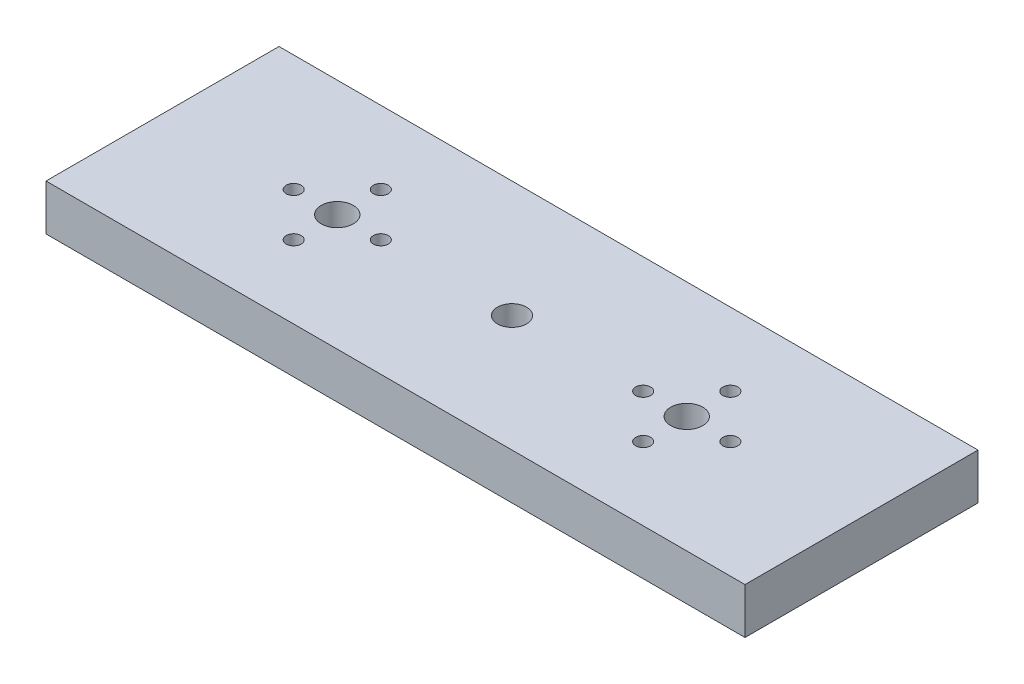
from build123d import *

# Parameters (mm, degrees)
SKETCH2_W                 = 304.8
SKETCH2_H                 = 101.6
SKETCH2_R                 = 6.35
SKETCH2_R_2               = 7
BOSS_EXTRUDE1_DEPTH       = 20
SKETCH3_R                 = 3.25
CUT_EXTRUDE1_DEPTH        = 162.883909021
CIRPATTERN1_COUNT         = 4
LPATTERN1_COUNT           = 2
LPATTERN1_PITCH           = 152.4
LPATTERN1_COPY_1_SKETCH_R = 3.25
LPATTERN1_COPY_1_DEPTH    = 162.883909021
LPATTERN1_COPY_2_SKETCH_R = 3.25
LPATTERN1_COPY_2_DEPTH    = 162.883909021
LPATTERN1_COPY_3_SKETCH_R = 3.25
LPATTERN1_COPY_3_DEPTH    = 162.883909021


with BuildPart() as part:
    # Sketch2 → Boss-Extrude1 (new body)
    with BuildSketch(Plane(origin=(0, 0, 0), x_dir=(1, 0, 0), z_dir=(0, 1, 0))):
        Rectangle(SKETCH2_W, SKETCH2_H)
        with Locations(Location((0, 0, 0), (0, 0, 270))):
            Circle(SKETCH2_R, mode=Mode.SUBTRACT)
        with Locations(Location((-76.2, 0, 0), (0, 0, 270))):
            Circle(SKETCH2_R_2, mode=Mode.SUBTRACT)
        with Locations(Location((76.2, 0, 0), (0, 0, 270))):
            Circle(SKETCH2_R_2, mode=Mode.SUBTRACT)
    extrude(amount=BOSS_EXTRUDE1_DEPTH)

    # Sketch3 → Cut-Extrude1 (cut, through all)
    with BuildSketch(Plane(origin=(0, 20, 0), x_dir=(1, 0, 0), z_dir=(0, 1, 0))):
        with Locations(Location((-76.2, 19, 0), (0, 0, 270))):
            Circle(SKETCH3_R)
    cut_extrude1 = extrude(amount=-CUT_EXTRUDE1_DEPTH, mode=Mode.SUBTRACT)

    # CirPattern1: Cut-Extrude1 ×4 about axis
    cirpattern1_axis = Axis((-76.2, 0, 0), (0, 1, 0))
    for i in range(1, CIRPATTERN1_COUNT):
        add(cut_extrude1.rotate(cirpattern1_axis, i * 360 / CIRPATTERN1_COUNT), mode=Mode.SUBTRACT)

    # LPattern1: Cut-Extrude1 ×2
    with Locations(*[(i * LPATTERN1_PITCH, 0, 0) for i in range(1, LPATTERN1_COUNT)]):
        add(cut_extrude1, mode=Mode.SUBTRACT)

    # LPattern1 copy 1 sketch → LPattern1 copy 1 (cut, through all)
    with BuildSketch(Plane(origin=(76.2, 20, -76.2), x_dir=(0, 0, -1), z_dir=(0, 1, 0))):
        with Locations(Location((-76.2, 19, 0), (0, 0, 270))):
            Circle(LPATTERN1_COPY_1_SKETCH_R)
    extrude(amount=-LPATTERN1_COPY_1_DEPTH, mode=Mode.SUBTRACT)

    # LPattern1 copy 2 sketch → LPattern1 copy 2 (cut, through all)
    with BuildSketch(Plane(origin=(0, 20, 0), x_dir=(-1, 0, 0), z_dir=(0, 1, 0))):
        with Locations(Location((-76.2, 19, 0), (0, 0, 270))):
            Circle(LPATTERN1_COPY_2_SKETCH_R)
    extrude(amount=-LPATTERN1_COPY_2_DEPTH, mode=Mode.SUBTRACT)

    # LPattern1 copy 3 sketch → LPattern1 copy 3 (cut, through all)
    with BuildSketch(Plane(origin=(76.2, 20, 76.2), x_dir=(0, 0, 1), z_dir=(0, 1, 0))):
        with Locations(Location((-76.2, 19, 0), (0, 0, 270))):
            Circle(LPATTERN1_COPY_3_SKETCH_R)
    extrude(amount=-LPATTERN1_COPY_3_DEPTH, mode=Mode.SUBTRACT)


solid = part.part
